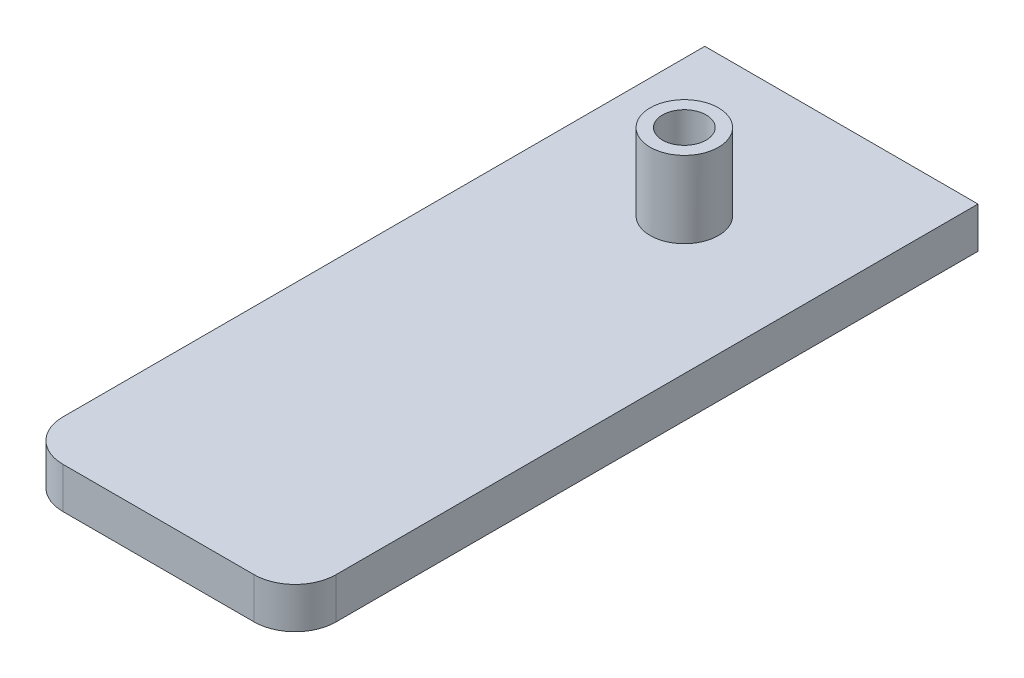
from build123d import *

# Parameters (mm, degrees)
SKETCH1_W           = 20
SKETCH1_H           = 50
BOSS_EXTRUDE1_DEPTH = 3
SKETCH3_R           = 1.6
CUT_EXTRUDE1_DEPTH  = 10
SKETCH4_R           = 2.5
SKETCH4_R_2         = 1.599999999
BOSS_EXTRUDE4_DEPTH = 5.6
FILLET1_R           = 3


with BuildPart() as part:
    # Sketch1 → Boss-Extrude1 (new body)
    with BuildSketch(Plane(origin=(0, 0, 0), x_dir=(1, 0, 0), z_dir=(0, 1, 0))):
        Rectangle(SKETCH1_W, SKETCH1_H)
    extrude(amount=BOSS_EXTRUDE1_DEPTH)

    # Sketch3 → Cut-Extrude1 (cut)
    with BuildSketch(Plane.XZ):
        with Locations(Location((0, -13.5, 0), (0, 0, 270))):
            Circle(SKETCH3_R)
    extrude(amount=-CUT_EXTRUDE1_DEPTH, mode=Mode.SUBTRACT)

    # Sketch4 → Boss-Extrude4 (add)
    with BuildSketch(Plane(origin=(0, 3, 0), x_dir=(1, 0, 0), z_dir=(0, 1, 0))):
        with Locations(Location((1e-09, 13.5, 0), (0, 0, 90))):
            Circle(SKETCH4_R)
        with Locations(Location((1e-09, 13.5, 0), (0, 0, 90.000000022))):
            Circle(SKETCH4_R_2, mode=Mode.SUBTRACT)
    extrude(amount=BOSS_EXTRUDE4_DEPTH)

    # Fillet1
    fillet1_edges = [part.edges().sort_by_distance(p)[0] for p in [
        (10, 1.5, 25),
        (-10, 1.5, 25),
    ]]
    fillet(fillet1_edges, radius=FILLET1_R)


solid = part.part
